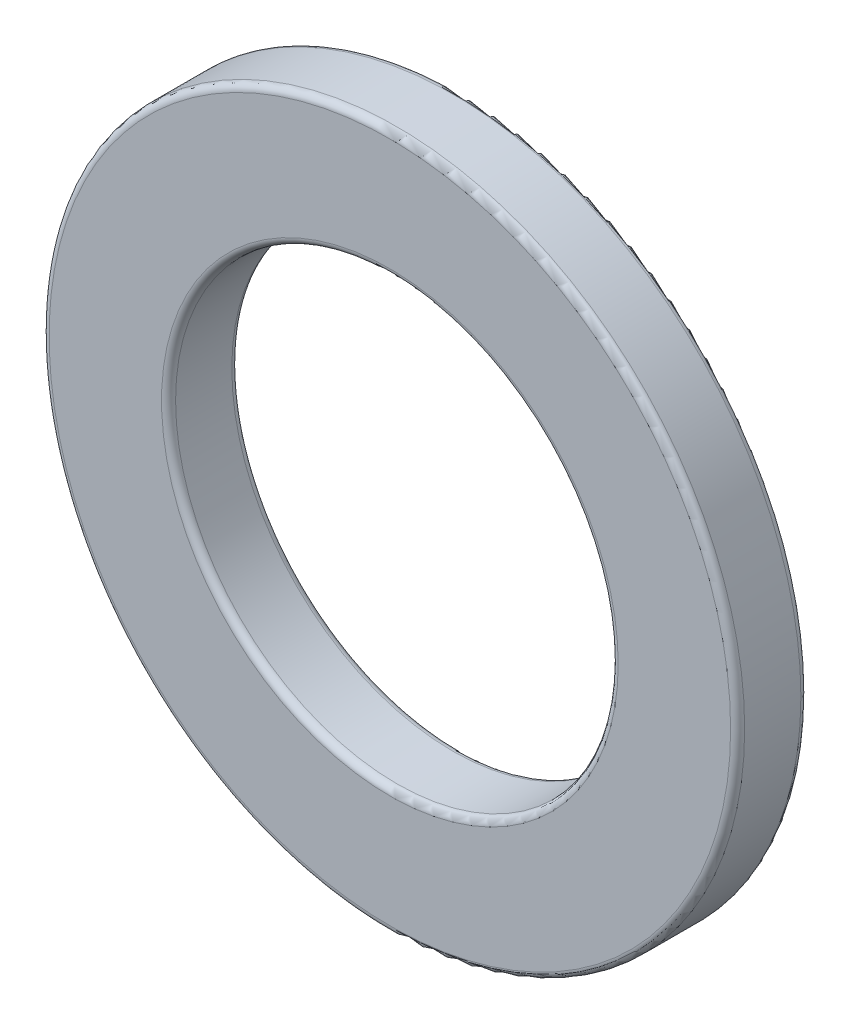
from build123d import *

# Parameters (mm, degrees)
SKETCH2_R           = 2.475
SKETCH2_R_2         = 1.575
BOSS_EXTRUDE1_DEPTH = 0.5
FILLET2_R           = 0.05


with BuildPart() as part:
    # Sketch2 → Boss-Extrude1 (new body)
    with BuildSketch(Plane.XY):
        Circle(SKETCH2_R)
        Circle(SKETCH2_R_2, mode=Mode.SUBTRACT)
    extrude(amount=BOSS_EXTRUDE1_DEPTH)

    # Fillet2
    fillet2_edges = [part.edges().sort_by_distance(p)[0] for p in [
        (-2.475, 0, 0),
        (-2.475, 0, 0.5),
        (-1.575, 0, 0),
        (-1.575, 0, 0.5),
    ]]
    fillet(fillet2_edges, radius=FILLET2_R)


solid = part.part
